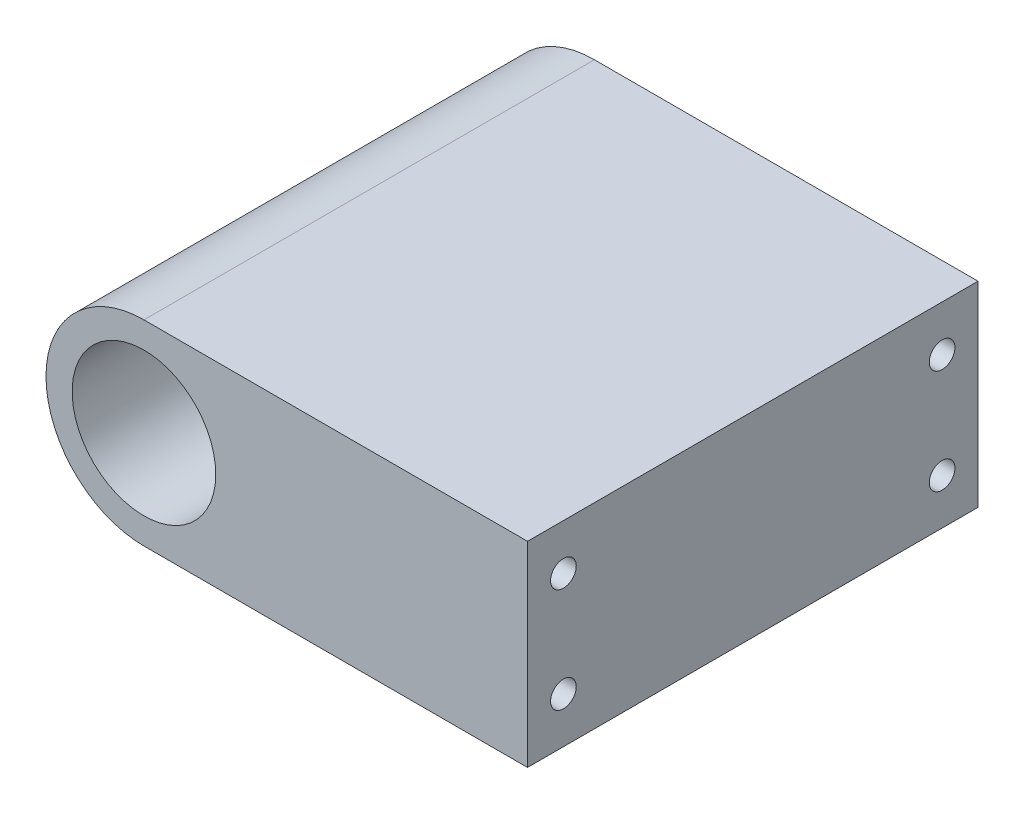
from build123d import *

# Parameters (mm, degrees)
SKETCH1_R                 = 13.97
BOSS_EXTRUDE1_DEPTH       = 87.63
FILLET3_R                 = 2.794
M6X1_0_TAPPED_HOLE1_D     = 5
M6X1_0_TAPPED_HOLE1_DEPTH = 41.148
M6X1_0_TAPPED_HOLE1_TIP   = 1.502151548


with BuildPart() as part:
    # Sketch1 → Boss-Extrude1 (new body)
    with BuildSketch(Plane.XY):
        with BuildLine():
            Line((0, 19.05), (74.609999878, 19.05))
            Line((74.609999878, 19.05), (74.609999878, -19.05))
            Line((74.609999878, -19.05), (0, -19.05))
            ThreePointArc((0, -19.05), (-19.05, 0), (0, 19.05))
        make_face()
        Circle(SKETCH1_R, mode=Mode.SUBTRACT)
    extrude(amount=BOSS_EXTRUDE1_DEPTH)

    # Fillet3
    fillet3_edges = [part.edges().sort_by_distance(p)[0] for p in [
        (-13.97, 0, 0),
    ]]
    fillet(fillet3_edges, radius=FILLET3_R)

    # M6x1.0 Tapped Hole1
    with Locations(Plane(origin=(74.609999878, 0, 0), x_dir=(0, 0, -1), z_dir=(1, 0, 0))):
        with Locations((-80.645, -10.16), (-80.645, 10.16), (-6.985, 10.16), (-6.985, -10.16)):
            Hole(M6X1_0_TAPPED_HOLE1_D / 2, depth=M6X1_0_TAPPED_HOLE1_DEPTH)
            with Locations((0, 0, -(M6X1_0_TAPPED_HOLE1_DEPTH + M6X1_0_TAPPED_HOLE1_TIP / 2))):  # 118° drill point
                Cone(0, M6X1_0_TAPPED_HOLE1_D / 2, M6X1_0_TAPPED_HOLE1_TIP, mode=Mode.SUBTRACT)


solid = part.part
